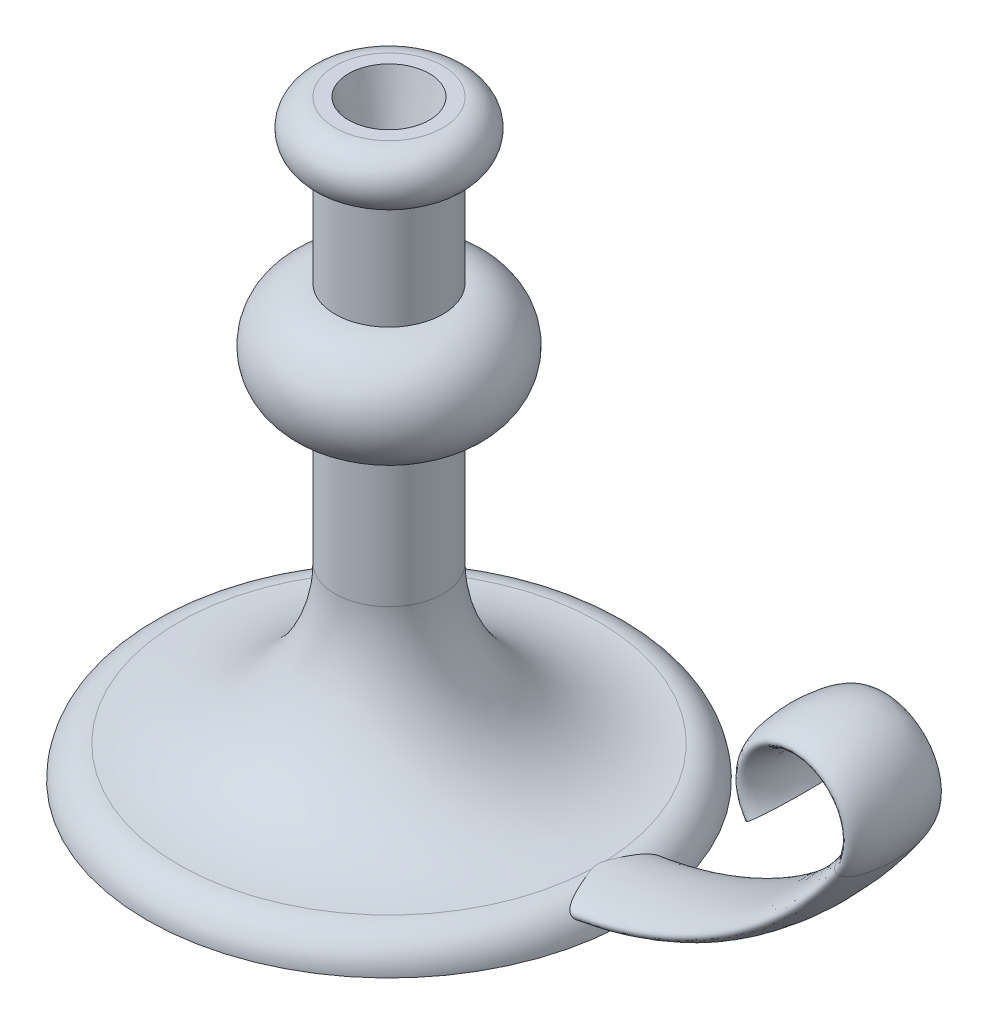
from build123d import *

# Parameters (mm, degrees)
SKETCH3_RX         = 17.5
SKETCH3_RY         = 5
SKETCH4_R          = 15
CUT_EXTRUDE1_DEPTH = 25
CUT_EXTRUDE1_DRAFT = -15


with BuildPart() as part:
    # Sketch1 → Revolve1 (revolve)
    with BuildSketch(Plane.XY, mode=Mode.PRIVATE) as revolve1_sk:
        with BuildLine():
            Line((0, 0), (0, 220))
            Line((0, 220), (20, 220))
            ThreePointArc((20, 220), (30, 210), (20, 200))
            Line((20, 200), (20, 160))
            ThreePointArc((20, 160), (40, 140), (20, 120))
            Line((20, 120), (20, 70))
            ThreePointArc((20, 70), (37.026622792, 28.894096333), (78.132526459, 11.867473541))
            ThreePointArc((78.132526459, 11.867473541), (86.524097475, 8.391571017), (90, 0))
            Line((90, 0), (0, 0))
        make_face()
    revolve(revolve1_sk.sketch.rotate(Axis((0, 0, 0), (0, 1, 0)), 90), axis=Axis((0, 0, 0), (0, 1, 0)))

    # Sweep1: sweep along a path in Sketch2
    with BuildLine(Plane.XY) as sweep1_path:
        Line((0, 5.799669953), (60, 5.799669953))
        ThreePointArc((60, 5.799669953), (129.821200219, 23.040489479), (183.592070943, 70.799669953))
        ThreePointArc((183.592070943, 70.799669953), (167.113128151, 102.133003286), (150.634185358, 70.799669953))
    # Sketch3 → Sweep1 (sweep)
    with BuildSketch(Plane(origin=(0, 0, 0), x_dir=(0, 0, -1), z_dir=(1, 0, 0))):
        with Locations((0, 5.799669953)):
            Ellipse(SKETCH3_RX, SKETCH3_RY)
    sweep(path=sweep1_path.line)


with BuildPart() as cut_extrude1_tool:
    # Sketch4 → Cut-Extrude1 (with draft: the straight prism first)
    with BuildSketch(Plane(origin=(0, 220, 0), x_dir=(1, 0, 0), z_dir=(0, 1, 0))):
        Circle(SKETCH4_R)
    extrude(amount=-CUT_EXTRUDE1_DEPTH)
    # Cut-Extrude1: the draft: its side faces are tilted about the plane it starts from
    cut_extrude1_sides = [cut_extrude1_tool.faces().sort_by_distance(p)[0] for p in [
        (-15, 207.5, 0),
    ]]
    draft(cut_extrude1_sides, Plane(origin=(0, 220, 0), x_dir=(1, 0, 0), z_dir=(0, 1, 0)), CUT_EXTRUDE1_DRAFT)


with BuildPart() as part_1:
    add(part.part)

    # Cut-Extrude1: cut by cut_extrude1_tool
    add(cut_extrude1_tool.part, mode=Mode.SUBTRACT)


solid = part_1.part
